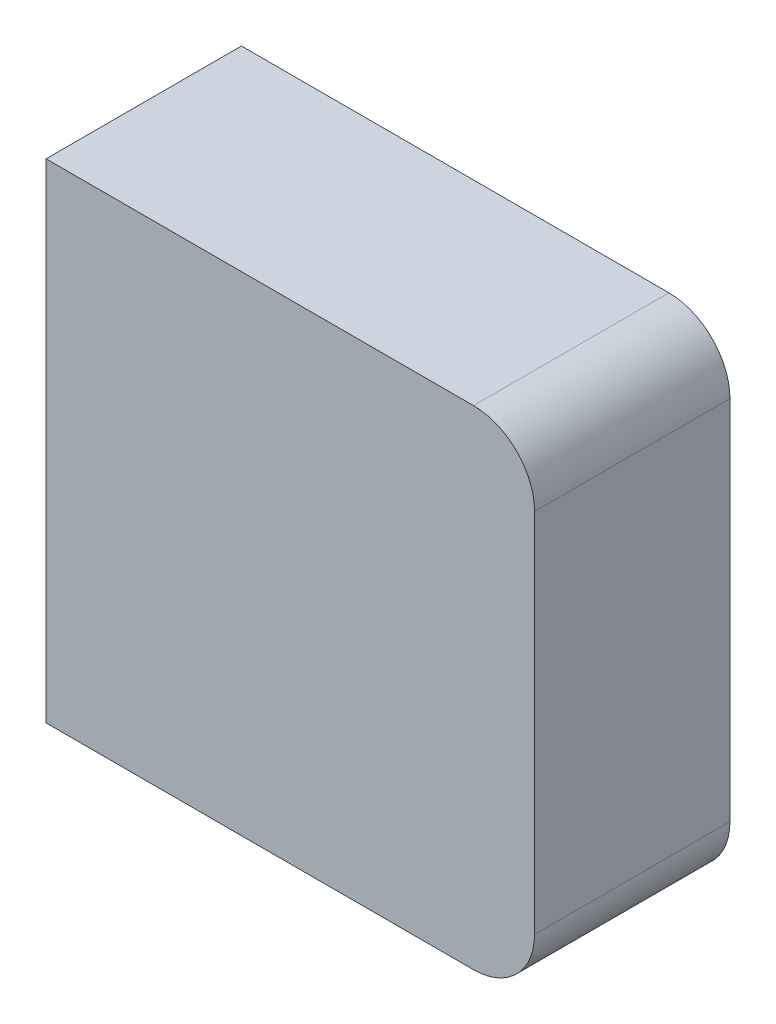
from build123d import *

# Parameters (mm, degrees)
SKETCH2_W                              = 20
SKETCH2_H                              = 20
BOSS_EXTRUDE1_DEPTH                    = 4
FILLET1_R                              = 2.5
TAPPED_HOLE_FOR_M4X0_7_HELICOIL1_D     = 4.2
TAPPED_HOLE_FOR_M4X0_7_HELICOIL1_DEPTH = 6.8
TAPPED_HOLE_FOR_M4X0_7_HELICOIL1_TIP   = 1.2618073


with BuildPart() as part:
    # Sketch2 → Boss-Extrude1 (new, symmetric)
    with BuildSketch(Plane.XY):
        Rectangle(SKETCH2_W, SKETCH2_H)
    extrude(amount=BOSS_EXTRUDE1_DEPTH, both=True)

    # Fillet1
    fillet1_edges = [part.edges().sort_by_distance(p)[0] for p in [
        (10, 10, 0),
        (10, -10, 0),
    ]]
    fillet(fillet1_edges, radius=FILLET1_R)

    # Tapped Hole for M4x0.7 Helicoil1
    with Locations(Plane.ZY.offset(10)):
        with Locations((0, 5), (0, -5)):
            Hole(TAPPED_HOLE_FOR_M4X0_7_HELICOIL1_D / 2, depth=TAPPED_HOLE_FOR_M4X0_7_HELICOIL1_DEPTH)
            with Locations((0, 0, -(TAPPED_HOLE_FOR_M4X0_7_HELICOIL1_DEPTH + TAPPED_HOLE_FOR_M4X0_7_HELICOIL1_TIP / 2))):  # 118° drill point
                Cone(0, TAPPED_HOLE_FOR_M4X0_7_HELICOIL1_D / 2, TAPPED_HOLE_FOR_M4X0_7_HELICOIL1_TIP, mode=Mode.SUBTRACT)


solid = part.part
